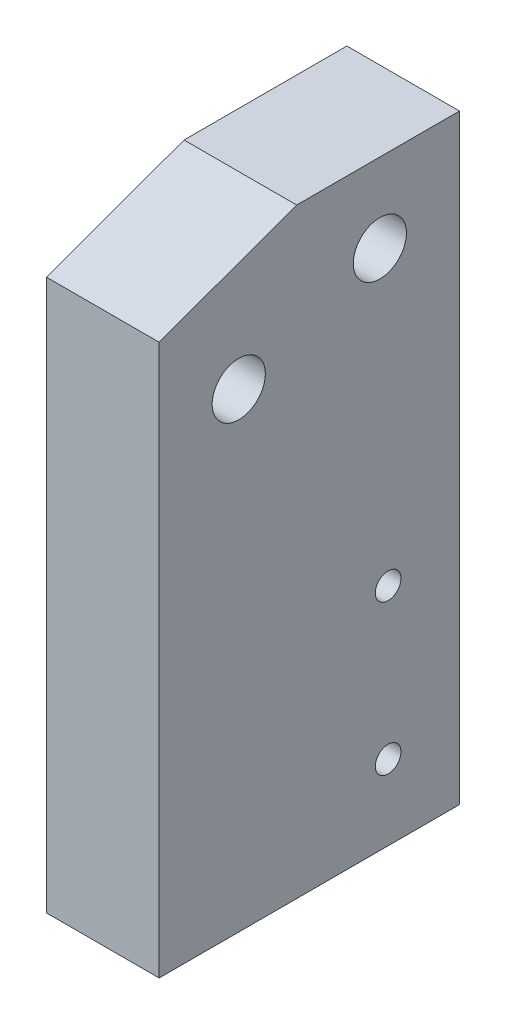
from build123d import *

# Parameters (mm, degrees)
SKETCH1_W                        = 28.575
SKETCH1_H                        = 76.2
BOSS_EXTRUDE1_DEPTH              = 152.4
F_1_2_CLEARANCE_HOLE1_D          = 13.49248
TAP_DRILL_FOR_5_16_18_TAP1_D     = 6.5278
TAP_DRILL_FOR_5_16_18_TAP1_DEPTH = 12.7
TAP_DRILL_FOR_5_16_18_TAP1_TIP   = 1.961148974
TAP_DRILL_FOR_5_16_18_TAP2_D     = 6.5278
TAP_DRILL_FOR_5_16_18_TAP2_DEPTH = 12.7
TAP_DRILL_FOR_5_16_18_TAP2_TIP   = 1.961148974
CUT_EXTRUDE1_DEPTH               = 173.767851827


with BuildPart() as part:
    # Sketch1 → Boss-Extrude1 (new body)
    with BuildSketch(Plane(origin=(0, 0, 0), x_dir=(1, 0, 0), z_dir=(0, 1, 0))):
        with Locations((14.2875, 38.1)):
            Rectangle(SKETCH1_W, SKETCH1_H)
    extrude(amount=BOSS_EXTRUDE1_DEPTH)

    # 1/2 Clearance Hole1 (through all)
    with Locations(Plane(origin=(28.575, 119.317250344, -20.198855574), x_dir=(0, 0, 1), z_dir=(1, 0, 0))):
        with Locations((0, 0), (-35.802288852, -13.030967461)):
            Hole(F_1_2_CLEARANCE_HOLE1_D / 2)

    # Tap Drill for 5/16-18 Tap1
    with Locations(Plane(origin=(28.575, 0, 0), x_dir=(0, 0, -1), z_dir=(1, 0, 0))):
        with Locations((58.1, 57.15), (58.1, 19.05)):
            Hole(TAP_DRILL_FOR_5_16_18_TAP1_D / 2, depth=TAP_DRILL_FOR_5_16_18_TAP1_DEPTH)
            with Locations((0, 0, -(TAP_DRILL_FOR_5_16_18_TAP1_DEPTH + TAP_DRILL_FOR_5_16_18_TAP1_TIP / 2))):  # 118° drill point
                Cone(0, TAP_DRILL_FOR_5_16_18_TAP1_D / 2, TAP_DRILL_FOR_5_16_18_TAP1_TIP, mode=Mode.SUBTRACT)

    # Tap Drill for 5/16-18 Tap2
    with Locations(Plane.ZY):
        with Locations((-18.1, 57.15), (-18.1, 19.05)):
            Hole(TAP_DRILL_FOR_5_16_18_TAP2_D / 2, depth=TAP_DRILL_FOR_5_16_18_TAP2_DEPTH)
            with Locations((0, 0, -(TAP_DRILL_FOR_5_16_18_TAP2_DEPTH + TAP_DRILL_FOR_5_16_18_TAP2_TIP / 2))):  # 118° drill point
                Cone(0, TAP_DRILL_FOR_5_16_18_TAP2_D / 2, TAP_DRILL_FOR_5_16_18_TAP2_TIP, mode=Mode.SUBTRACT)

    # Sketch12 → Cut-Extrude1 (cut, through all)
    with BuildSketch(Plane.ZY):
        Polygon((-34.892963227, 152.4), (0, 139.7), (0, 152.4), align=None)
    extrude(amount=-CUT_EXTRUDE1_DEPTH, mode=Mode.SUBTRACT)


solid = part.part
